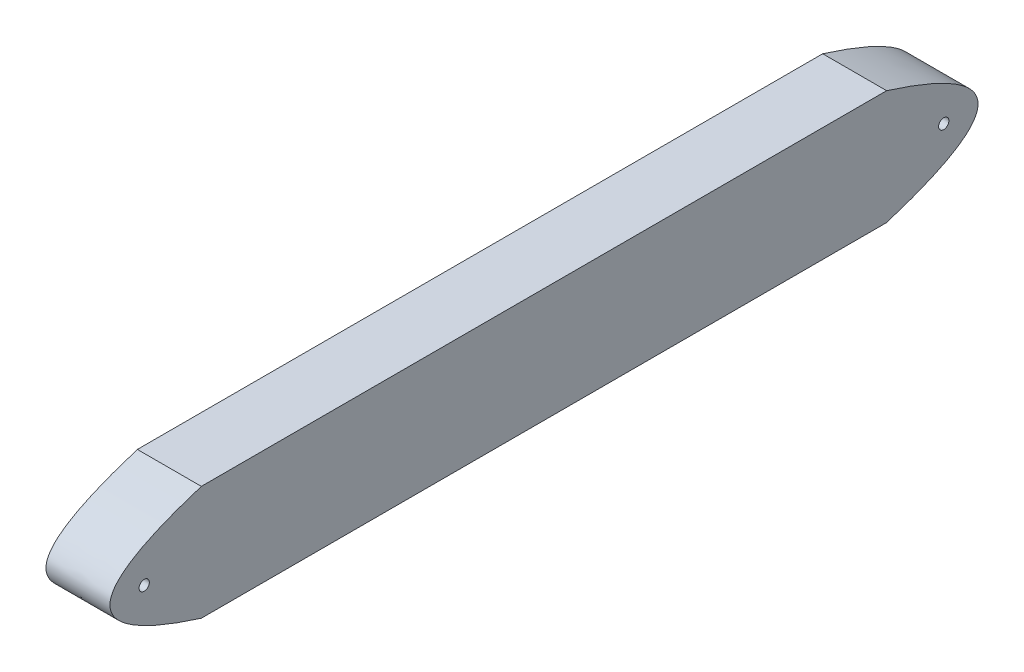
from build123d import *

# Parameters (mm, degrees)
SKETCH1_R           = 2.25
BOSS_EXTRUDE1_DEPTH = 28


with BuildPart() as part:
    # Sketch1 → Boss-Extrude1 (new body)
    with BuildSketch(Plane(origin=(0, 0, 0), x_dir=(0, 0, -1), z_dir=(1, 0, 0))):
        with BuildLine():
            Line((-150, 25), (150, 25))
            add(Edge.make_bspline(
                [(150, 25), (230, 0), (150, -25)],
                knots=[0, 0, 0, 1, 1, 1], degree=2))
            Line((150, -25), (-150, -25))
            add(Edge.make_bspline(
                [(-150, 25), (-230, 0), (-150, -25)],
                knots=[0, 0, 0, 1, 1, 1], degree=2))
        make_face()
        with Locations((-175, 0)):
            Circle(SKETCH1_R, mode=Mode.SUBTRACT)
        with Locations((175, 0)):
            Circle(SKETCH1_R, mode=Mode.SUBTRACT)
    extrude(amount=BOSS_EXTRUDE1_DEPTH)


solid = part.part
